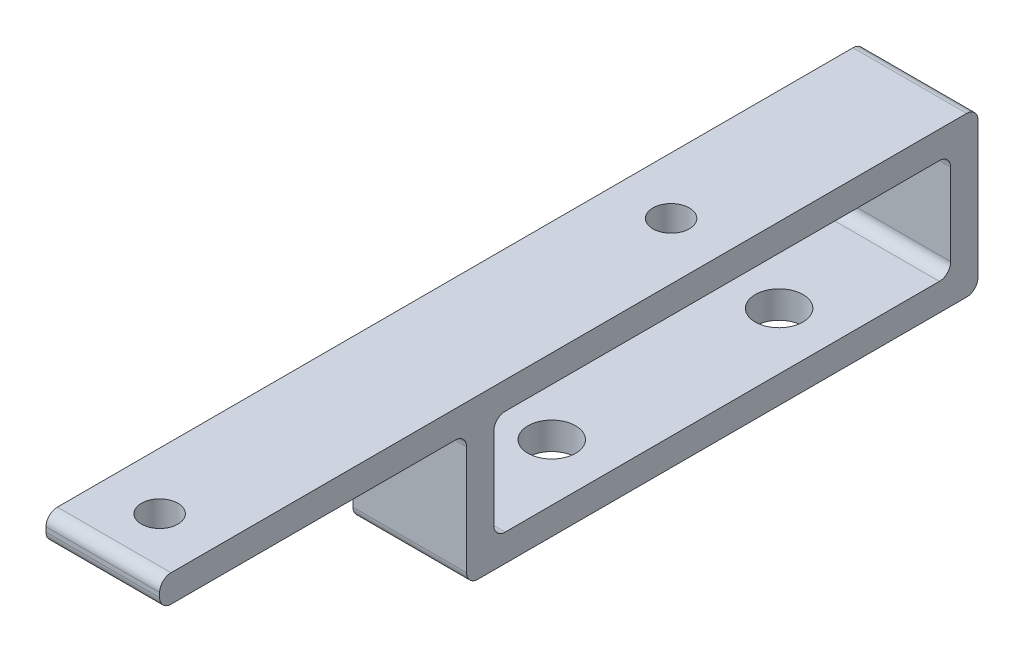
from build123d import *

# Parameters (mm, degrees)
BOSS_EXTRUDE1_DEPTH = 10
SKETCH4_W           = 40.2
SKETCH4_H           = 9.2
CUT_EXTRUDE1_DEPTH  = 49.176757882
SKETCH3_R           = 2.1
CUT_EXTRUDE2_DEPTH  = 2.4
SKETCH5_R           = 1.6
CUT_EXTRUDE3_DEPTH  = 2.4
FILLET1_R           = 1


with BuildPart() as part:
    # Sketch1 → Boss-Extrude1 (new body)
    with BuildSketch(Plane(origin=(0, 0, 0), x_dir=(0, 0, -1), z_dir=(1, 0, 0))):
        Polygon((0, 11.6), (0, 0), (45, 0), (45, 14), (0, 14), (-27, 14), (-27, 11.6), align=None)
    extrude(amount=BOSS_EXTRUDE1_DEPTH)

    # Sketch4 → Cut-Extrude1 (cut, through all)
    with BuildSketch(Plane(origin=(10, 0, 0), x_dir=(0, 0, -1), z_dir=(1, 0, 0))):
        with Locations((22.5, 7)):
            Rectangle(SKETCH4_W, SKETCH4_H)
    extrude(amount=-CUT_EXTRUDE1_DEPTH, mode=Mode.SUBTRACT)

    # Sketch3 → Cut-Extrude2 (cut)
    with BuildSketch(Plane(origin=(0, 0, 0), x_dir=(1, 0, 0), z_dir=(0, 1, 0))):
        with Locations(Location((5, 32.5, 0), (0, 0, 90))):
            Circle(SKETCH3_R)
        with Locations(Location((5, 12.5, 0), (0, 0, 90))):
            Circle(SKETCH3_R)
    extrude(amount=CUT_EXTRUDE2_DEPTH, mode=Mode.SUBTRACT)

    # Sketch5 → Cut-Extrude3 (cut)
    with BuildSketch(Plane(origin=(0, 14, 0), x_dir=(1, 0, 0), z_dir=(0, 1, 0))):
        with Locations(Location((5, 23, 0), (0, 0, 270))):
            Circle(SKETCH5_R)
        with Locations(Location((5, -22, 0), (0, 0, 270))):
            Circle(SKETCH5_R)
    extrude(amount=-CUT_EXTRUDE3_DEPTH, mode=Mode.SUBTRACT)

    # Fillet1
    fillet1_edges = [part.edges().sort_by_distance(p)[0] for p in [
        (5, 0, 0),
        (5, 11.6, 0),
        (5, 11.6, 27),
        (5, 14, 27),
        (5, 14, -45),
        (5, 0, -45),
        (5, 2.4, -2.4),
        (5, 11.6, -2.4),
        (5, 11.6, -42.6),
        (5, 2.4, -42.6),
    ]]
    fillet(fillet1_edges, radius=FILLET1_R)


solid = part.part
